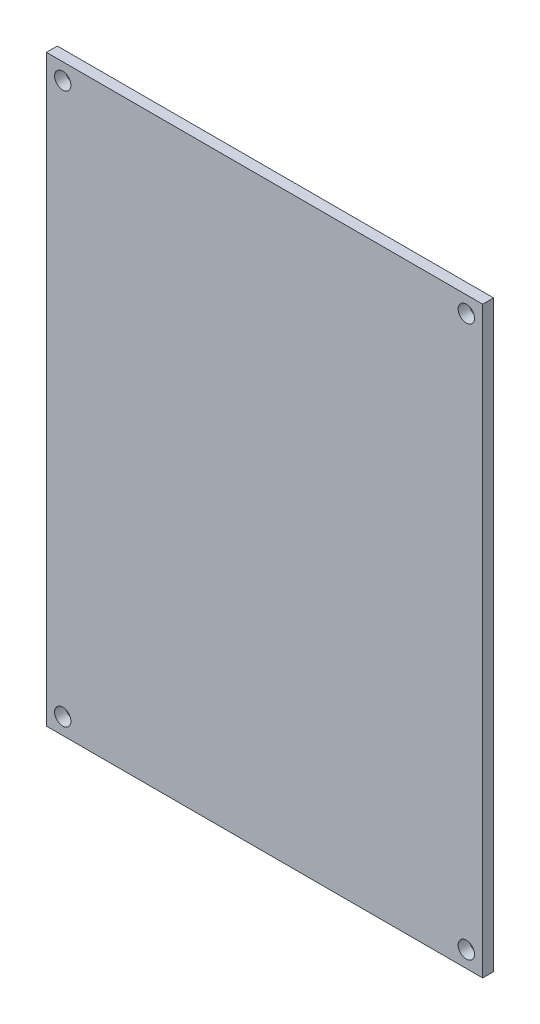
from build123d import *

# Parameters (mm, degrees)
IZIM1_W                     = 80
IZIM1_H                     = 107
IZIM1_R                     = 1.5
Y_KSEKLIK_EKSTR_ZYON1_DEPTH = 2


with BuildPart() as part:
    # Çizim1 → Yükseklik-Ekstrüzyon1 (new body)
    with BuildSketch(Plane.XY):
        with Locations((40, 53.5)):
            Rectangle(IZIM1_W, IZIM1_H)
        with Locations((3, 3)):
            Circle(IZIM1_R, mode=Mode.SUBTRACT)
        with Locations((77, 3)):
            Circle(IZIM1_R, mode=Mode.SUBTRACT)
        with Locations((77, 104)):
            Circle(IZIM1_R, mode=Mode.SUBTRACT)
        with Locations((3, 104)):
            Circle(IZIM1_R, mode=Mode.SUBTRACT)
    extrude(amount=Y_KSEKLIK_EKSTR_ZYON1_DEPTH)


solid = part.part
